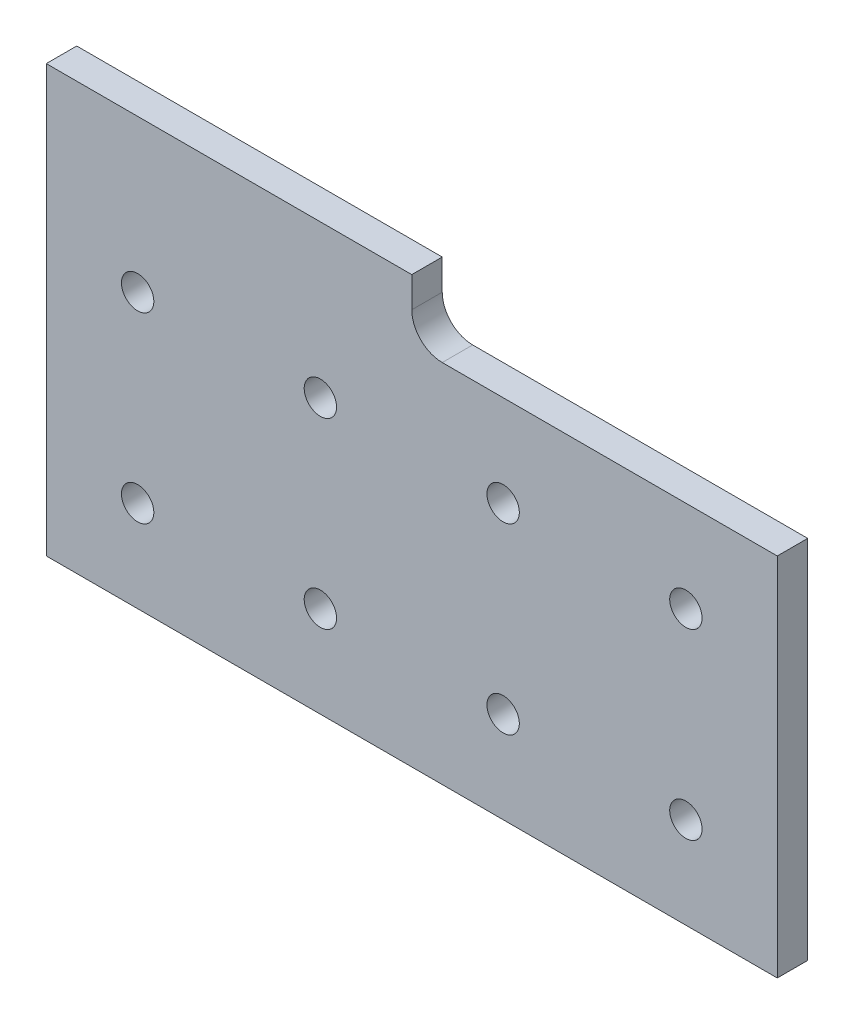
from build123d import *

# Parameters (mm, degrees)
SKETCH1_W                        = 152.4
SKETCH1_H                        = 88.9
BOSS_EXTRUDE1_DEPTH              = 6.35
F_17_64_0_26563_DIAMETER_HOLE1_D = 6.747002
LPATTERN1_COUNT                  = 4
LPATTERN1_PITCH                  = 38.1
LPATTERN1_COUNT_DIR2             = 2
LPATTERN1_PITCH_DIR2             = 38.1
SKETCH4_W                        = 76.2
SKETCH4_H                        = 12.7
CUT_EXTRUDE1_DEPTH               = 177.548272436
FILLET1_R                        = 6.35


with BuildPart() as part:
    # Sketch1 → Boss-Extrude1 (new body)
    with BuildSketch(Plane.XY):
        with Locations((76.2, 44.45)):
            Rectangle(SKETCH1_W, SKETCH1_H)
    extrude(amount=BOSS_EXTRUDE1_DEPTH)

    # 17/64 (0.26563) Diameter Hole1 (through all)
    with Locations(Plane.XY.offset(6.35)):
        with Locations((19.05, 19.05)):
            f_17_64_0_26563_diameter_hole1 = Hole(F_17_64_0_26563_DIAMETER_HOLE1_D / 2)

    # LPattern1: 17_64 _0.26563_ Diameter Hole1 4 × 2
    with Locations(*[(i * LPATTERN1_PITCH, j * LPATTERN1_PITCH_DIR2, 0) for i in range(LPATTERN1_COUNT) for j in range(LPATTERN1_COUNT_DIR2) if (i, j) != (0, 0)]):
        add(f_17_64_0_26563_diameter_hole1, mode=Mode.SUBTRACT)

    # Sketch4 → Cut-Extrude1 (cut, through all)
    with BuildSketch(Plane.XY.offset(6.35)):
        with Locations((114.3, 82.55)):
            Rectangle(SKETCH4_W, SKETCH4_H)
    extrude(amount=-CUT_EXTRUDE1_DEPTH, mode=Mode.SUBTRACT)

    # Fillet1
    fillet1_edges = [part.edges().sort_by_distance(p)[0] for p in [
        (76.2, 76.2, 3.175),
    ]]
    fillet(fillet1_edges, radius=FILLET1_R)


solid = part.part
